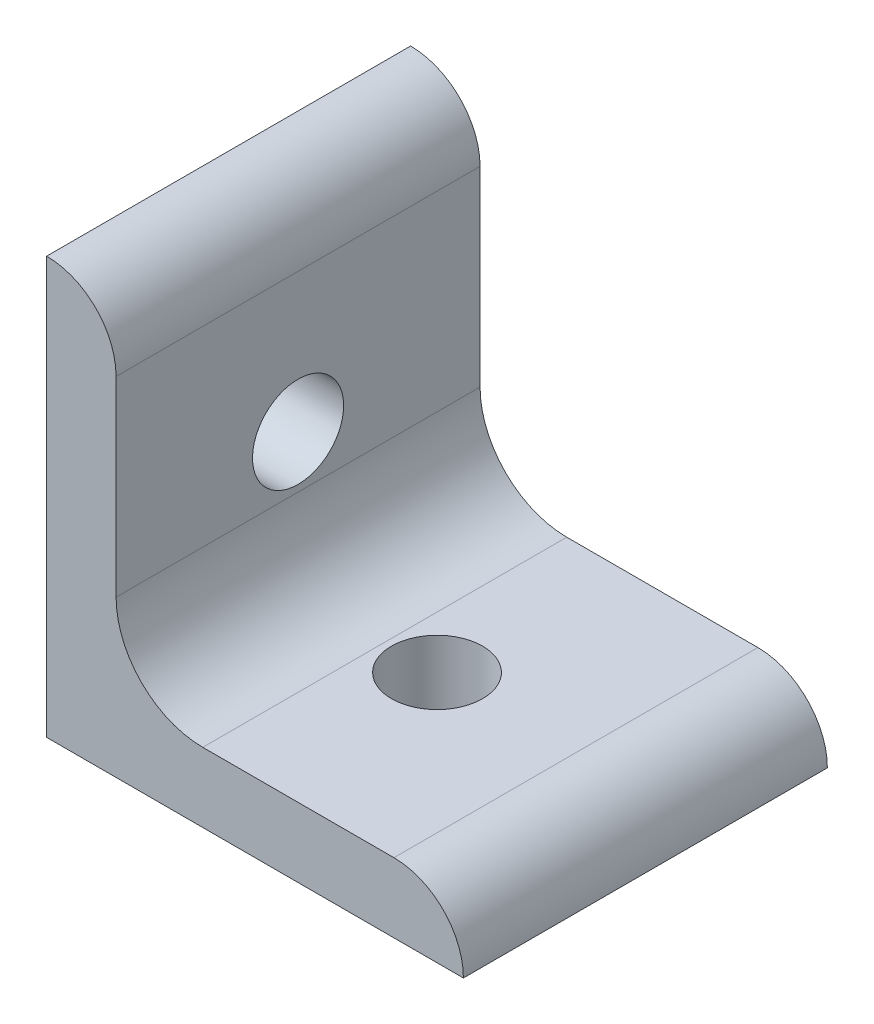
from build123d import *

# Parameters (mm, degrees)
BOSS_EXTRUDE1_DEPTH = 16.637
SKETCH2_R           = 4.1656
CUT_EXTRUDE1_DEPTH  = 57.391575337
SKETCH3_R           = 4.1656
CUT_EXTRUDE2_DEPTH  = 57.391575337


with BuildPart() as part:
    # Sketch1 → Boss-Extrude1 (new, symmetric)
    with BuildSketch(Plane.XY):
        with BuildLine():
            Line((0, 0), (0, 38.1))
            ThreePointArc((0, 38.1), (4.490128061, 36.240128061), (6.35, 31.75))
            Line((6.35, 31.75), (6.35, 14.2748))
            ThreePointArc((6.35, 14.2748), (8.67112018, 8.67112018), (14.2748, 6.35))
            Line((14.2748, 6.35), (31.75, 6.35))
            ThreePointArc((31.75, 6.35), (36.240128061, 4.490128061), (38.1, 0))
            Line((38.1, 0), (0, 0))
        make_face()
    extrude(amount=BOSS_EXTRUDE1_DEPTH, both=True)

    # Sketch2 → Cut-Extrude1 (cut, through all)
    with BuildSketch(Plane(origin=(0, 0, 0), x_dir=(1, 0, 0), z_dir=(0, 1, 0))):
        with Locations(Location((19.05, 0, 0), (0, 0, 90))):
            Circle(SKETCH2_R)
    extrude(amount=CUT_EXTRUDE1_DEPTH, mode=Mode.SUBTRACT)

    # Sketch3 → Cut-Extrude2 (cut, through all)
    with BuildSketch(Plane(origin=(0, 0, 0), x_dir=(0, 0, -1), z_dir=(1, 0, 0))):
        with Locations(Location((0, 19.05, 0), (0, 0, 270))):
            Circle(SKETCH3_R)
    extrude(amount=CUT_EXTRUDE2_DEPTH, mode=Mode.SUBTRACT)


solid = part.part
